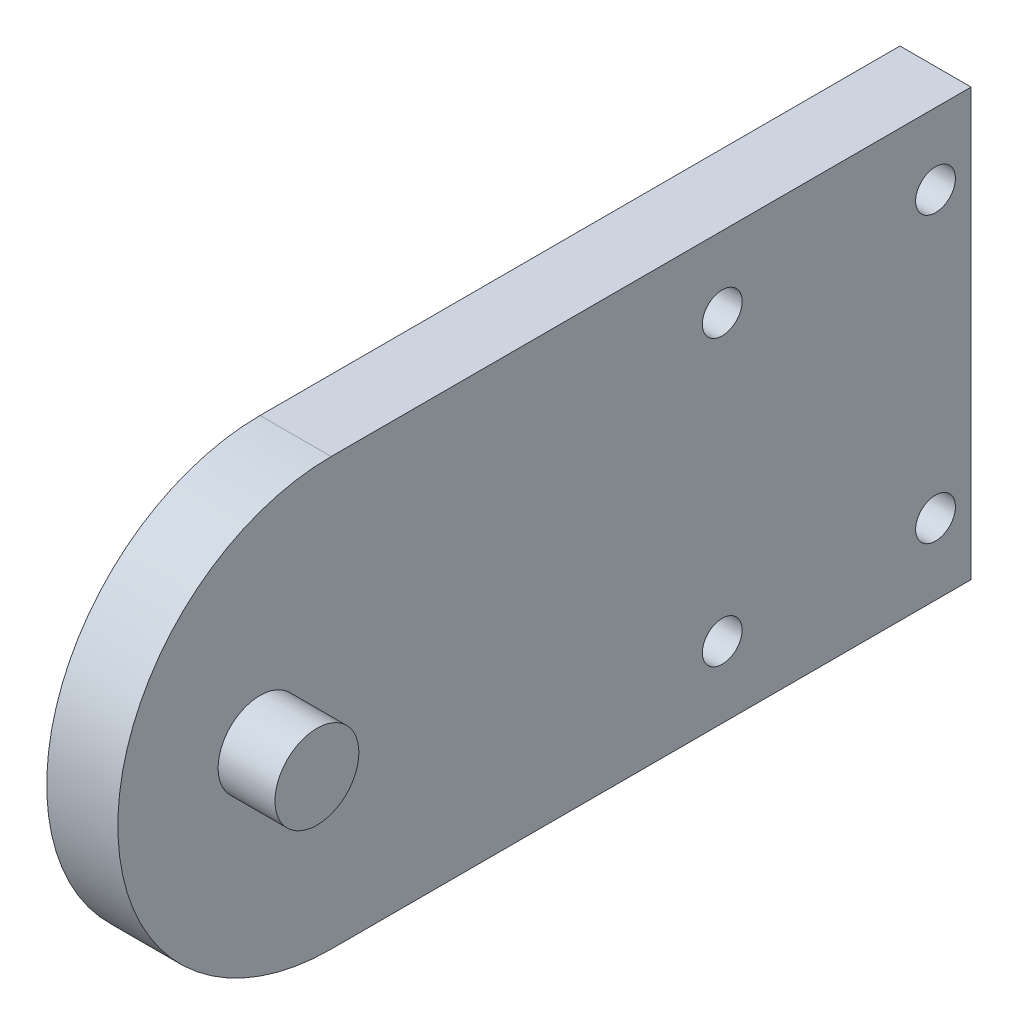
from build123d import *

# Parameters (mm, degrees)
SKETCH1_W           = 5
SKETCH1_H           = 60
BOSS_EXTRUDE1_DEPTH = 30
SKETCH3_R           = 1.4
CUT_EXTRUDE1_DEPTH  = 6
SKETCH2_R           = 2.95
BOSS_EXTRUDE2_DEPTH = 4
CUT_EXTRUDE2_DEPTH  = 10


with BuildPart() as part:
    # Sketch1 → Boss-Extrude1 (new body)
    with BuildSketch(Plane(origin=(0, 0, 0), x_dir=(1, 0, 0), z_dir=(0, 1, 0))):
        Rectangle(SKETCH1_W, SKETCH1_H)
    extrude(amount=BOSS_EXTRUDE1_DEPTH)

    # Sketch3 → Cut-Extrude1 (cut)
    with BuildSketch(Plane.ZY.offset(2.5)):
        with Locations((-27.5, 25)):
            Circle(SKETCH3_R)
        with Locations((-12.5, 25)):
            Circle(SKETCH3_R)
        with Locations((-12.5, 5)):
            Circle(SKETCH3_R)
        with Locations((-27.5, 5)):
            Circle(SKETCH3_R)
    extrude(amount=-CUT_EXTRUDE1_DEPTH, mode=Mode.SUBTRACT)

    # Sketch2 → Boss-Extrude2 (add)
    with BuildSketch(Plane(origin=(2.5, 0, 0), x_dir=(0, 0, -1), z_dir=(1, 0, 0))):
        with Locations(Location((-20, 15, 0), (0, 0, 180))):
            Circle(SKETCH2_R)
    extrude(amount=BOSS_EXTRUDE2_DEPTH)

    # Sketch4 → Cut-Extrude2 (cut)
    with BuildSketch(Plane.ZY.offset(2.5)):
        with BuildLine():
            Line((30, 0), (30, 15))
            ThreePointArc((30, 15), (25.606601718, 4.393398282), (15, 0))
            Line((15, 0), (30, 0))
        make_face()
        with BuildLine():
            Line((30, 30), (15, 30))
            ThreePointArc((15, 30), (25.606601718, 25.606601718), (30, 15))
            Line((30, 15), (30, 30))
        make_face()
    extrude(amount=-CUT_EXTRUDE2_DEPTH, mode=Mode.SUBTRACT)


solid = part.part
